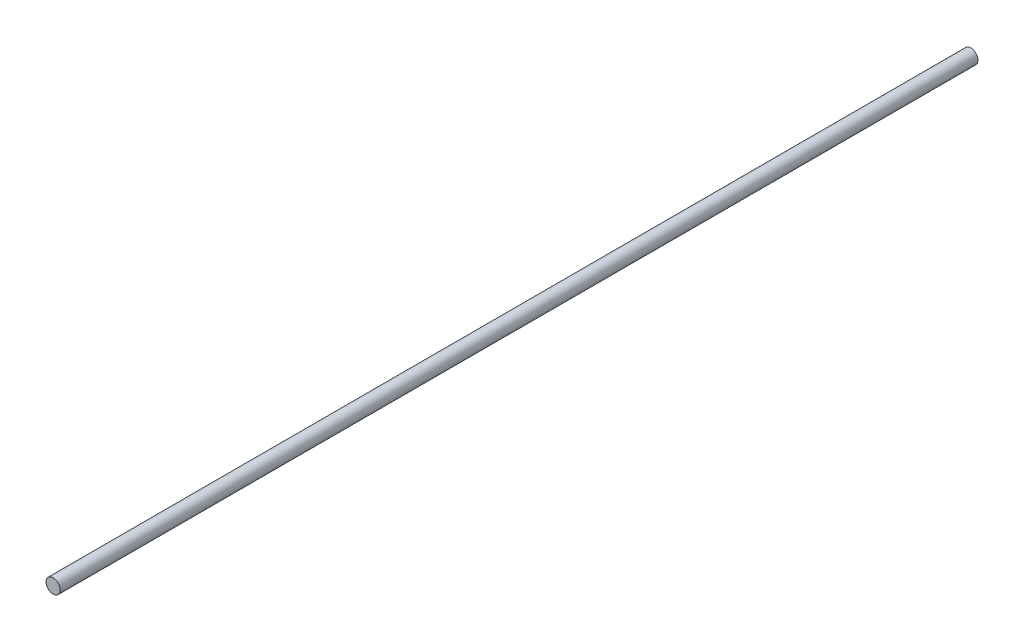
from build123d import *

# Parameters (mm, degrees)
SKETCH1_R    = 1.1811
RODEND_DEPTH = 152.4


with BuildPart() as part:
    # Sketch1 → RodEnd (new body)
    with BuildSketch(Plane.XY):
        Circle(SKETCH1_R)
    extrude(amount=-RODEND_DEPTH)


solid = part.part
